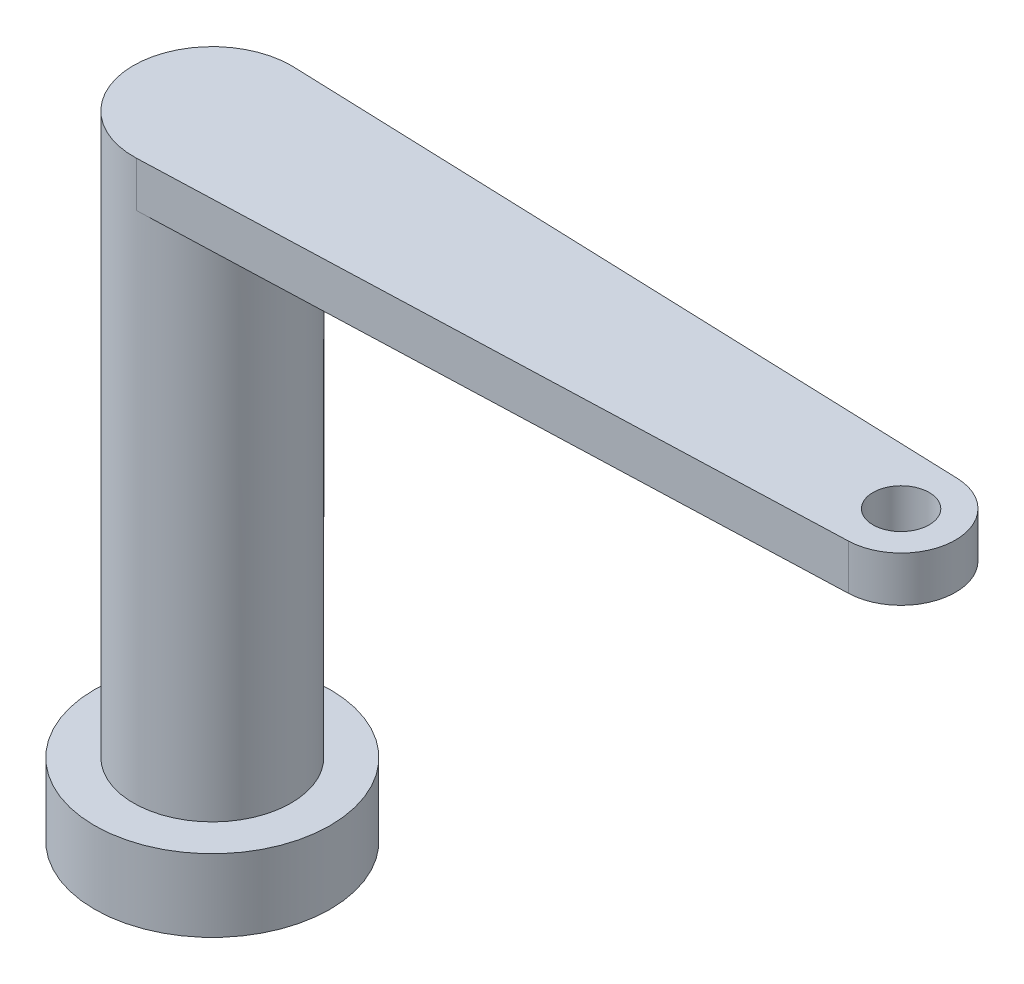
from build123d import *

# Parameters (mm, degrees)
SKETCH_2_R          = 1.5
CUT_EXTRUDE_5_DEPTH = 10
SKETCH_3_R          = 2.5
EXTRUDE_1_DEPTH     = 20
SKETCH_4_R          = 1.85
EXTRUDE_2_DEPTH     = 5
SKETCH_3_2_R        = 2.5
EXTRUDE_3_DEPTH     = 5.891507394
SKETCH_5_R          = 4.35
EXTRUDE_4_DEPTH     = 25
SKETCH_6_R          = 6.5
EXTRUDE_5_DEPTH     = 4
SKETCH_7_OUTSIDE_W  = 65.264
SKETCH_7_OUTSIDE_H  = 65.264
CUT_EXTRUDE_6_DEPTH = 5
SKETCH_8_R          = 1.55
EXTRUDE_6_DEPTH     = 2.5


with BuildPart() as part:
    # 草图1 → 旋转1 (revolve)
    with BuildSketch(Plane.XY, mode=Mode.PRIVATE) as revolve_1_sk:
        Polygon((3.461552813, 5.891507394), (1.4, 5.891507394), (1.4, 3.5), (2.5, 3.5), (2.5, 0), (4.35, 0), (4.35, 3.391507394), (24, 3.391507394), (24, 5.891507394), align=None)
    revolve(revolve_1_sk.sketch.rotate(Axis((0, 0, 0), (0, 1, 0)), 90), axis=Axis((0, 0, 0), (0, 1, 0)))

    # 草图2 → 切除-拉伸5 (cut)
    with BuildSketch(Plane(origin=(0, 5.891507394, 0), x_dir=(1, 0, 0), z_dir=(0, 1, 0))):
        with Locations(Location((-16, 0, 0), (0, 0, 270))):
            Circle(SKETCH_2_R)
        with Locations(Location((0, -16, 0), (0, 0, 270))):
            Circle(SKETCH_2_R)
        with Locations(Location((16, 0, 0), (0, 0, 270))):
            Circle(SKETCH_2_R)
        with Locations(Location((0, 16, 0), (0, 0, 270))):
            Circle(SKETCH_2_R)
    extrude(amount=-CUT_EXTRUDE_5_DEPTH, mode=Mode.SUBTRACT)



with BuildPart() as body_2:
    # 草图3 → 凸台-拉伸1 (new body)
    with BuildSketch(Plane.XZ):
        with Locations(Location((0, 0, 0), (0, 0, 270))):
            Circle(SKETCH_3_R)
    extrude(amount=EXTRUDE_1_DEPTH)

    # 草图4 → 凸台-拉伸2 (add)
    with BuildSketch(Plane.XZ.offset(20)):
        with Locations(Location((0, 0, 0), (0, 0, 270))):
            Circle(SKETCH_4_R)
    extrude(amount=EXTRUDE_2_DEPTH)


with BuildPart() as part_1:
    add(part.part)

    add(body_2.part)  # 凸台-拉伸3 merges body 2
    # 草图3<2> → 凸台-拉伸3 (add)
    with BuildSketch(Plane.XZ):
        with Locations(Location((0, 0, 0), (0, 0, 270))):
            Circle(SKETCH_3_2_R)
    extrude(amount=-EXTRUDE_3_DEPTH)

    # 草图5 → 凸台-拉伸4 (add, through all)
    with BuildSketch(Plane.XZ):
        with Locations(Location((0, 0, 0), (0, 0, 270))):
            Circle(SKETCH_5_R)
    extrude(amount=EXTRUDE_4_DEPTH)

    # 草图6 → 凸台-拉伸5 (add)
    with BuildSketch(Plane.XZ.offset(25)):
        with Locations(Location((0, 0, 0), (0, 0, 270))):
            Circle(SKETCH_6_R)
    extrude(amount=EXTRUDE_5_DEPTH)

    # 草图7 outside → 切除-拉伸6 (cut)
    with BuildSketch(Plane(origin=(0, 5.891507394, 0), x_dir=(1, 0, 0), z_dir=(0, 1, 0))):
        Rectangle(SKETCH_7_OUTSIDE_W, SKETCH_7_OUTSIDE_H)
        with BuildLine():
            Line((0.36703125, 4.334488212), (16.253125, 2.989302215))
            ThreePointArc((16.253125, 2.989302215), (19, 0), (16.253125, -2.989302215))
            Line((16.253125, -2.989302215), (0.36703125, -4.334488212))
            ThreePointArc((0.36703125, -4.334488212), (-4.35, 0), (0.36703125, 4.334488212))
        make_face(mode=Mode.SUBTRACT)
    extrude(amount=-CUT_EXTRUDE_6_DEPTH, mode=Mode.SUBTRACT)

    # 草图8 → 凸台-拉伸6 (add)
    with BuildSketch(Plane(origin=(0, 5.891507394, 0), x_dir=(1, 0, 0), z_dir=(0, 1, 0))):
        with BuildLine():
            Line((0.154539474, 4.347254024), (38.106578947, 2.998106224))
            ThreePointArc((38.106578947, 2.998106224), (41, 0), (38.106578947, -2.998106224))
            Line((38.106578947, -2.998106224), (0.154539474, -4.347254024))
            ThreePointArc((0.154539474, -4.347254024), (-4.35, 0), (0.154539474, 4.347254024))
        make_face()
        with Locations(Location((38, 0, 0), (0, 0, 270))):
            Circle(SKETCH_8_R, mode=Mode.SUBTRACT)
    extrude(amount=-EXTRUDE_6_DEPTH)


solid = part_1.part
